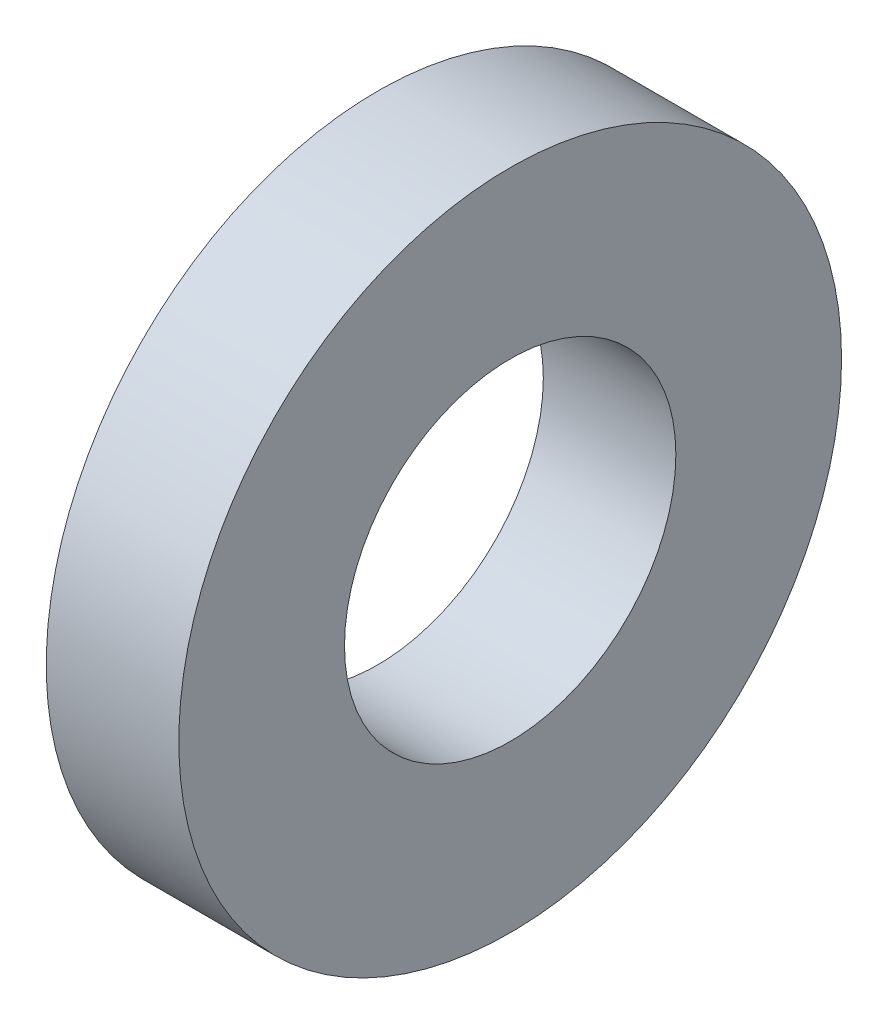
from build123d import *

# Parameters (mm, degrees)
SKETCH1_R           = 2.5
SKETCH1_R_2         = 1.25
BOSS_EXTRUDE1_DEPTH = 1


with BuildPart() as part:
    # Sketch1 → Boss-Extrude1 (new body)
    with BuildSketch(Plane(origin=(0, 0, 0), x_dir=(0, 0, -1), z_dir=(1, 0, 0))):
        Circle(SKETCH1_R)
        Circle(SKETCH1_R_2, mode=Mode.SUBTRACT)
    extrude(amount=BOSS_EXTRUDE1_DEPTH)


solid = part.part
